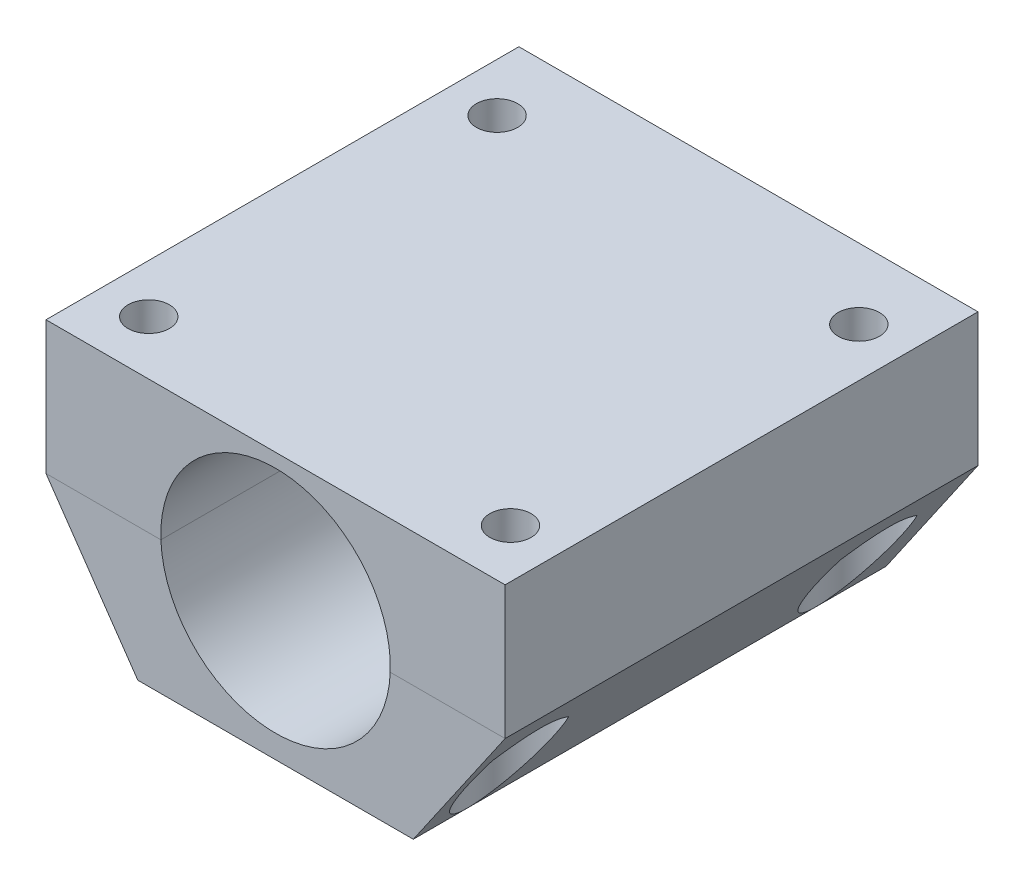
from build123d import *

# Parameters (mm, degrees)
ESQUISSE1_W                                    = 10
ESQUISSE1_H                                    = 14.5
ESQUISSE1_W_2                                  = 30
ESQUISSE1_H_2                                  = 29
ESQUISSE1_R                                    = 12.5
BOSS_EXTRU_1_DEPTH                             = 50
FRAISAGE_POUR_VIS_T_TE_FRAIS_E_M41_AT_COUNT    = 2
FRAISAGE_POUR_VIS_T_TE_FRAIS_E_M41_AT_PITCH    = 39.397349882
FRAISAGE_POUR_VIS_T_TE_FRAIS_E_M41_2_COUNT     = 2
FRAISAGE_POUR_VIS_T_TE_FRAIS_E_M41_2_PITCH     = 54.694216744
FRAISAGE_POUR_VIS_T_TE_FRAIS_E_M41_3_COUNT     = 2
FRAISAGE_POUR_VIS_T_TE_FRAIS_E_M41_3_PITCH     = 37.938188775
ESQUISSE26_R                                   = 3.75
BOSS_EXTRU_2_DEPTH                             = 1.5
FRAISAGE_POUR_VIS_T_TE_FRAIS_E_M31_D           = 3.4
FRAISAGE_POUR_VIS_T_TE_FRAIS_E_M31_CSINK_D     = 6.3
FRAISAGE_POUR_VIS_T_TE_FRAIS_E_M31_CSINK_ANGLE = 90


with BuildPart() as part:
    # Esquisse1 → Boss.-Extru.1 (new body)
    # profile 1 of 5: a face of its own
    with BuildSketch(Plane.XY):
        with Locations((-20, 6.75)):
            Rectangle(ESQUISSE1_W, ESQUISSE1_H)
    # profile 2 of 5: a face of its own
    with BuildSketch(Plane.XY):
        Polygon((-15, -15), (-15, -0.5), (-25, -0.5), align=None)
    # profile 3 of 5: a face of its own
    with BuildSketch(Plane.XY):
        with Locations((0, -0.5)):
            Rectangle(ESQUISSE1_W_2, ESQUISSE1_H_2)
        Circle(ESQUISSE1_R, mode=Mode.SUBTRACT)
    # profile 4 of 5: a face of its own
    with BuildSketch(Plane.XY):
        Polygon((25, -0.5), (15, -0.5), (15, -15), align=None)
    # profile 5 of 5: a face of its own
    with BuildSketch(Plane.XY):
        with Locations((20, 6.75)):
            Rectangle(ESQUISSE1_W, ESQUISSE1_H)
    extrude(amount=BOSS_EXTRU_1_DEPTH)

    # Esquisse25 → Fraisage pour vis à tête fraisée M41 (revolve, cut)
    with BuildSketch(Plane(origin=(19.698674941, -15, 6.176821723), x_dir=(0, 0, -1), z_dir=(1, 0, 0))):
        Polygon((0, 0), (0, 29), (2.25, 29), (2.25, 12.45), (4.7, 10), (4.7, 0), align=None)
    fraisage_pour_vis_t_te_frais_e_m41 = revolve(axis=Axis((19.698674941, -21.35, 6.176821723), (0, 1, 0)), mode=Mode.SUBTRACT)

    # Fraisage pour vis à tête fraisée M41 at: Fraisage pour vis à tête fraisée M41 ×2
    with Locations(*[(-i * FRAISAGE_POUR_VIS_T_TE_FRAIS_E_M41_AT_PITCH, 0, 0) for i in range(1, FRAISAGE_POUR_VIS_T_TE_FRAIS_E_M41_AT_COUNT)]):
        add(fraisage_pour_vis_t_te_frais_e_m41, mode=Mode.SUBTRACT)

    # Fraisage pour vis _ t_te frais_e M41 2: Fraisage pour vis à tête fraisée M41 ×2
    with Locations(*[Vector(-0.7203202134914811, 0, 0.6936416870658707) * (i * FRAISAGE_POUR_VIS_T_TE_FRAIS_E_M41_2_PITCH) for i in range(1, FRAISAGE_POUR_VIS_T_TE_FRAIS_E_M41_2_COUNT)]):
        add(fraisage_pour_vis_t_te_frais_e_m41, mode=Mode.SUBTRACT)

    # Fraisage pour vis _ t_te frais_e M41 3: Fraisage pour vis à tête fraisée M41 ×2
    with Locations(*[(0, 0, i * FRAISAGE_POUR_VIS_T_TE_FRAIS_E_M41_3_PITCH) for i in range(1, FRAISAGE_POUR_VIS_T_TE_FRAIS_E_M41_3_COUNT)]):
        add(fraisage_pour_vis_t_te_frais_e_m41, mode=Mode.SUBTRACT)

    # Esquisse26 → Boss.-Extru.2 (add)
    with BuildSketch(Plane(origin=(0, 0, 0), x_dir=(-1, 0, 0), z_dir=(0, 0, -1))):
        Polygon((-25, 14), (25, 14), (25, -0.5), (15, -15), (-15, -15), (-25, -0.5), align=None)
        Circle(ESQUISSE26_R, mode=Mode.SUBTRACT)
    extrude(amount=BOSS_EXTRU_2_DEPTH)

    # Fraisage pour vis à tête fraisée M31 (through all)
    with Locations(Plane(origin=(0, 0, -1.5), x_dir=(-1, 0, 0), z_dir=(0, 0, -1))):
        with Locations((-8.5, 0), (8.5, 0)):
            CounterSinkHole(FRAISAGE_POUR_VIS_T_TE_FRAIS_E_M31_D / 2, FRAISAGE_POUR_VIS_T_TE_FRAIS_E_M31_CSINK_D / 2, counter_sink_angle=FRAISAGE_POUR_VIS_T_TE_FRAIS_E_M31_CSINK_ANGLE)


with BuildPart() as body_2:
    # Fractionner1: the piece on the far side of the plane
    add(part.part)
    split(bisect_by=Plane.ZX.offset(-0.5), keep=Keep.BOTTOM)


with BuildPart() as part_1:
    add(part.part)

    # Fractionner1
    split(bisect_by=Plane.ZX.offset(-0.5), keep=Keep.TOP)


solid = Compound([body_2.part, part_1.part])
